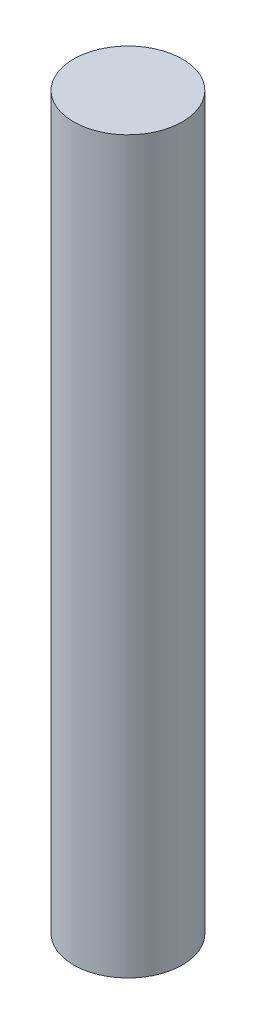
from build123d import *

# Parameters (mm, degrees)
SKETCH_1_R      = 7.45
EXTRUDE_1_DEPTH = 100


with BuildPart() as part:
    # 草图1 → 凸台-拉伸1 (new body)
    with BuildSketch(Plane(origin=(0, 0, 0), x_dir=(1, 0, 0), z_dir=(0, 1, 0))):
        with Locations(Location((0, 0, 0), (0, 0, 270))):
            Circle(SKETCH_1_R)
    extrude(amount=EXTRUDE_1_DEPTH)


solid = part.part
